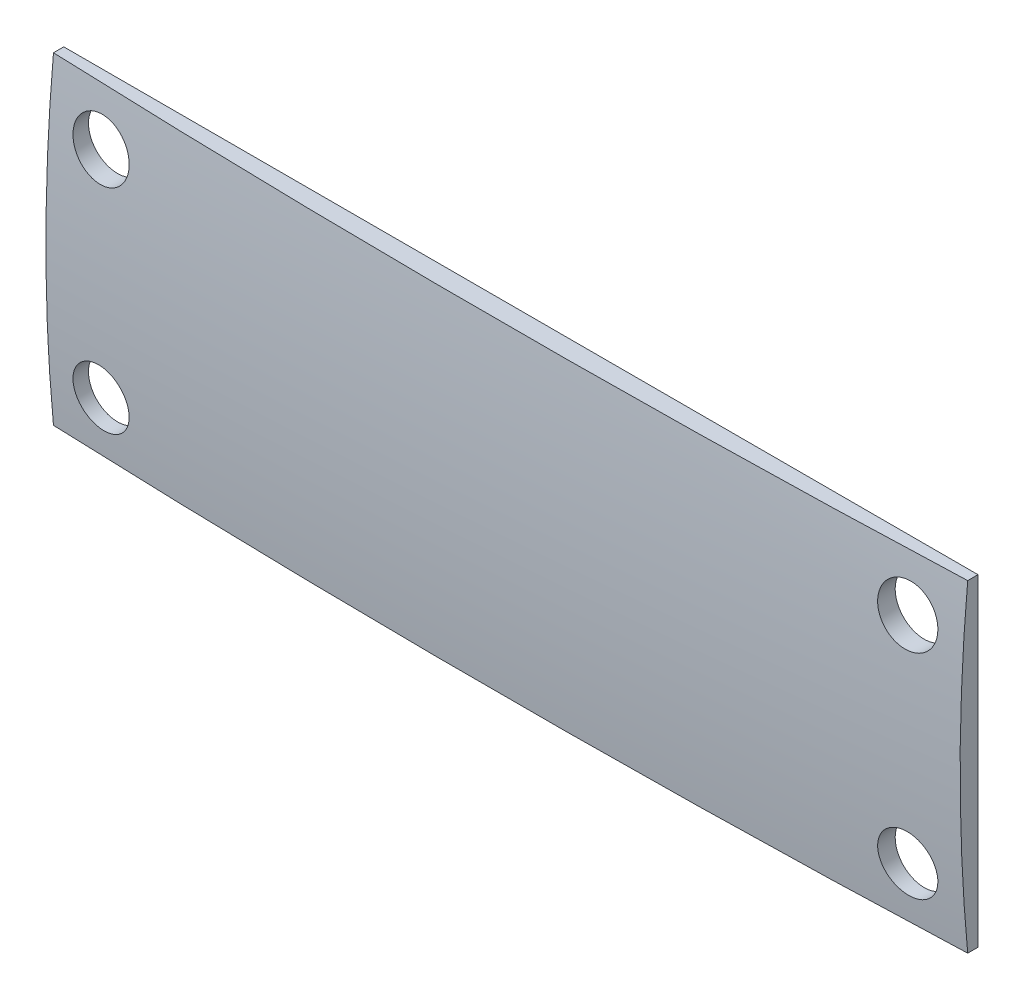
from build123d import *

# Parameters (mm, degrees)
SKETCH1_OUTSIDE_W       = 3552.458
SKETCH1_OUTSIDE_H       = 1860.818
SKETCH1_OUTSIDE_W_2     = 107.95
SKETCH1_OUTSIDE_H_2     = 38.1
CUT_EXTRUDE1_DEPTH      = 3115.745878548
CUT_EXTRUDE2_START      = -3.175
SKETCH3_W               = 107.95
SKETCH3_H               = 44.752430816
CUT_EXTRUDE2_DEPTH      = 2744.161532781
CUT_EXTRUDE3_DEPTH      = 58.326117654
CUT_EXTRUDE3_DEPTH_BACK = 58.326117654
SKETCH4_R               = 3.429


with BuildPart() as part:
    # Sketch2 → Revolve1 (revolve)
    with BuildSketch(Plane(origin=(0, 0, 0), x_dir=(0, 0, -1), z_dir=(1, 0, 0))):
        with BuildLine():
            Line((1372.87, -527.05), (1372.87, 527.05))
            add(Edge.make_bspline(
                [(1372.87, 527.05), (0, 527.05), (0, 0), (0, -527.05), (1372.87, -527.05)],
                knots=[4.71238898, 4.71238898, 4.71238898, 6.283185307, 6.283185307, 7.853981634, 7.853981634, 7.853981634], degree=2, weights=[1, 0.707106781, 1, 0.707106781, 1]))
        make_face()
    revolve(axis=Axis((0, -527.05, -1372.87), (0, 1, 0)))

    # Sketch1 outside → Cut-Extrude1 (cut, through all)
    with BuildSketch(Plane.XY):
        Rectangle(SKETCH1_OUTSIDE_W, SKETCH1_OUTSIDE_H)
        Rectangle(SKETCH1_OUTSIDE_W_2, SKETCH1_OUTSIDE_H_2, mode=Mode.SUBTRACT)
    extrude(amount=-CUT_EXTRUDE1_DEPTH, mode=Mode.SUBTRACT)

    # Sketch3 → Cut-Extrude2 (cut, through all)
    with BuildSketch(Plane.XY.offset(CUT_EXTRUDE2_START)):
        Rectangle(SKETCH3_W, SKETCH3_H)
    extrude(amount=-CUT_EXTRUDE2_DEPTH, mode=Mode.SUBTRACT)

    # Sketch4 → Cut-Extrude3 (cut, two sides: drawn at the far end of the back side and taken through both)
    with BuildSketch(Plane(origin=(0, 0, -3.175), x_dir=(-1, 0, 0), z_dir=(0, 0, -1)).offset(-CUT_EXTRUDE3_DEPTH_BACK)):
        with Locations((-47.625, -12.7)):
            Circle(SKETCH4_R)
        with Locations((-47.625, 12.7)):
            Circle(SKETCH4_R)
        with Locations((47.625, 12.7)):
            Circle(SKETCH4_R)
        with Locations((47.625, -12.7)):
            Circle(SKETCH4_R)
    extrude(amount=CUT_EXTRUDE3_DEPTH + CUT_EXTRUDE3_DEPTH_BACK, mode=Mode.SUBTRACT)


solid = part.part
